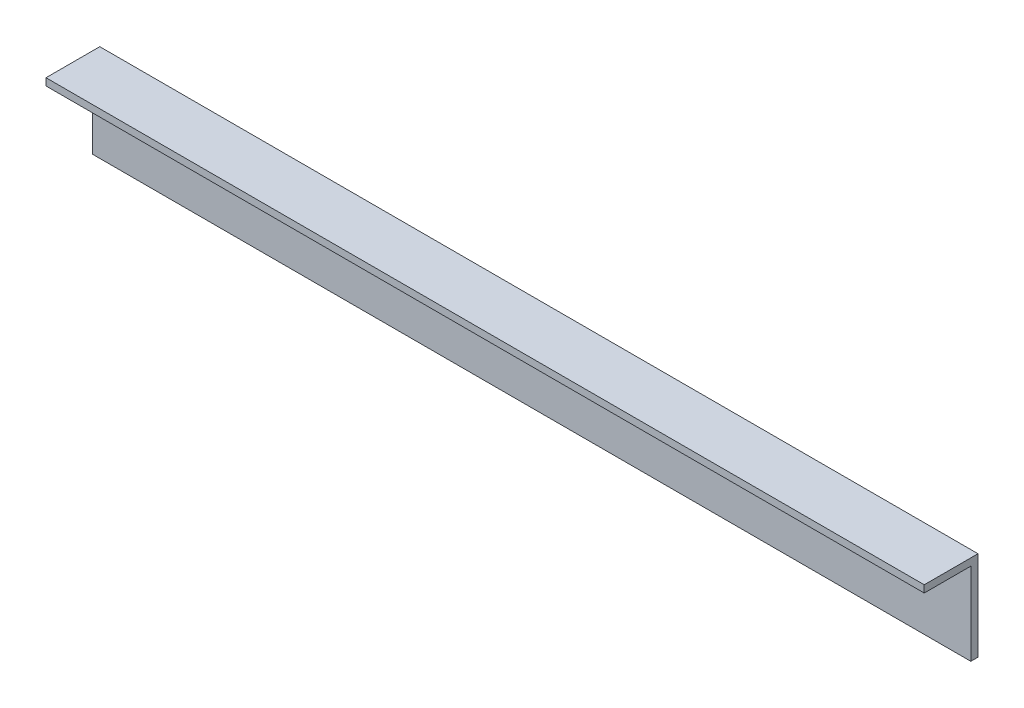
from build123d import *

# Parameters (mm, degrees)
SKETCH_1_W         = 1960
SKETCH_1_H         = 200
EXTRUDE_1465_DEPTH = 16
SKETCH_2_W         = 1960
SKETCH_2_H         = 16
EXTRUDE_1_DEPTH    = 104


with BuildPart() as part:
    # 草图1 → Extrude 1465 (new body)
    with BuildSketch(Plane.XY):
        with Locations((0, 100)):
            Rectangle(SKETCH_1_W, SKETCH_1_H)
    extrude(amount=EXTRUDE_1465_DEPTH)

    # 草图2 → 凸台-拉伸1 (add)
    with BuildSketch(Plane.XY.offset(16)):
        with Locations((0, 192)):
            Rectangle(SKETCH_2_W, SKETCH_2_H)
    extrude(amount=EXTRUDE_1_DEPTH)


solid = part.part
